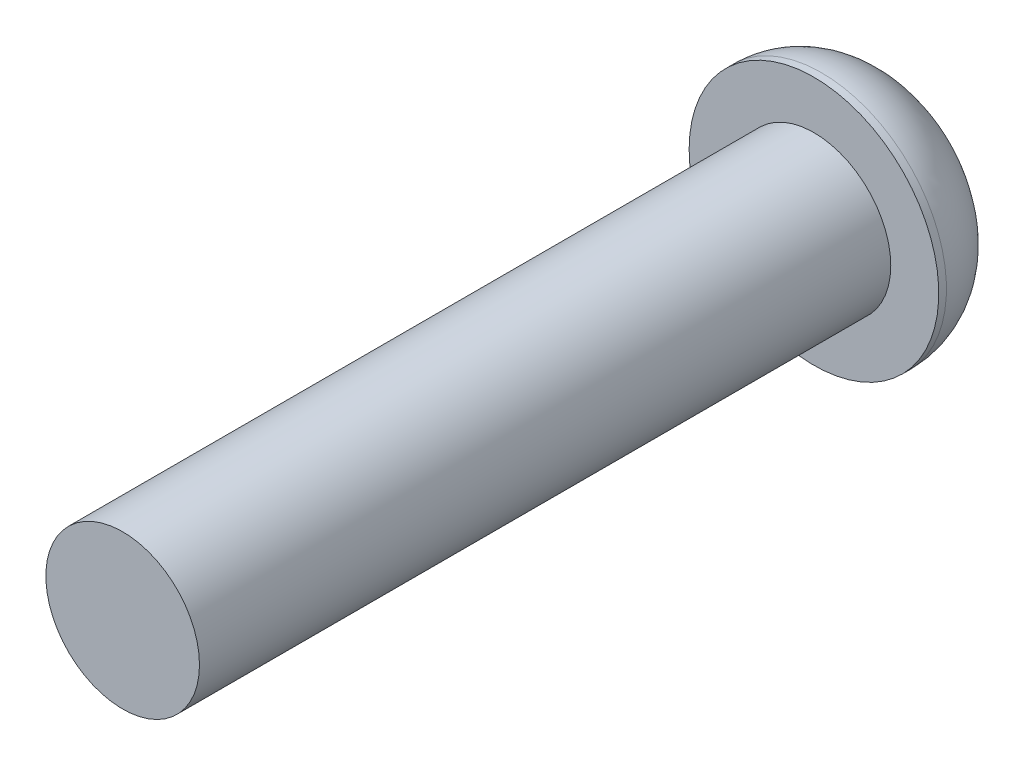
from build123d import *

# Parameters (mm, degrees)
SKETCH_1_R          = 2
EXTRUDE_1_DEPTH     = 18
SKETCH_2_R          = 3.25
EXTRUDE_2_DEPTH     = 2.2
FILLET_1_R          = 2
CUT_EXTRUDE_1_DEPTH = 0.5


with BuildPart() as part:
    # 草图1 → 凸台-拉伸1 (new body)
    with BuildSketch(Plane.XY):
        Circle(SKETCH_1_R)
    extrude(amount=EXTRUDE_1_DEPTH)

    # 草图2 → 凸台-拉伸2 (add)
    with BuildSketch(Plane(origin=(0, 0, 0), x_dir=(-1, 0, 0), z_dir=(0, 0, -1))):
        Circle(SKETCH_2_R)
    extrude(amount=EXTRUDE_2_DEPTH)

    # 圆角1
    fillet_1_edges = [part.edges().sort_by_distance(p)[0] for p in [
        (3.25, 0, -2.2),
    ]]
    fillet(fillet_1_edges, radius=FILLET_1_R)

    # 草图3 → 切除-拉伸1 (cut)
    with BuildSketch(Plane(origin=(0, 0, -2.2), x_dir=(-1, 0, 0), z_dir=(0, 0, -1))):
        Polygon((3.239974874, 0.25), (3.239974874, -0.25), (0.25, -0.25), (0.25, -3.239974874), (-0.25, -3.239974874), (-0.25, -0.25), (-3.239974874, -0.25), (-3.239974874, 0.25), (-0.25, 0.25), (-0.25, 3.239974874), (0.25, 3.239974874), (0.25, 0.25), align=None)
    extrude(amount=-CUT_EXTRUDE_1_DEPTH, mode=Mode.SUBTRACT)


solid = part.part
